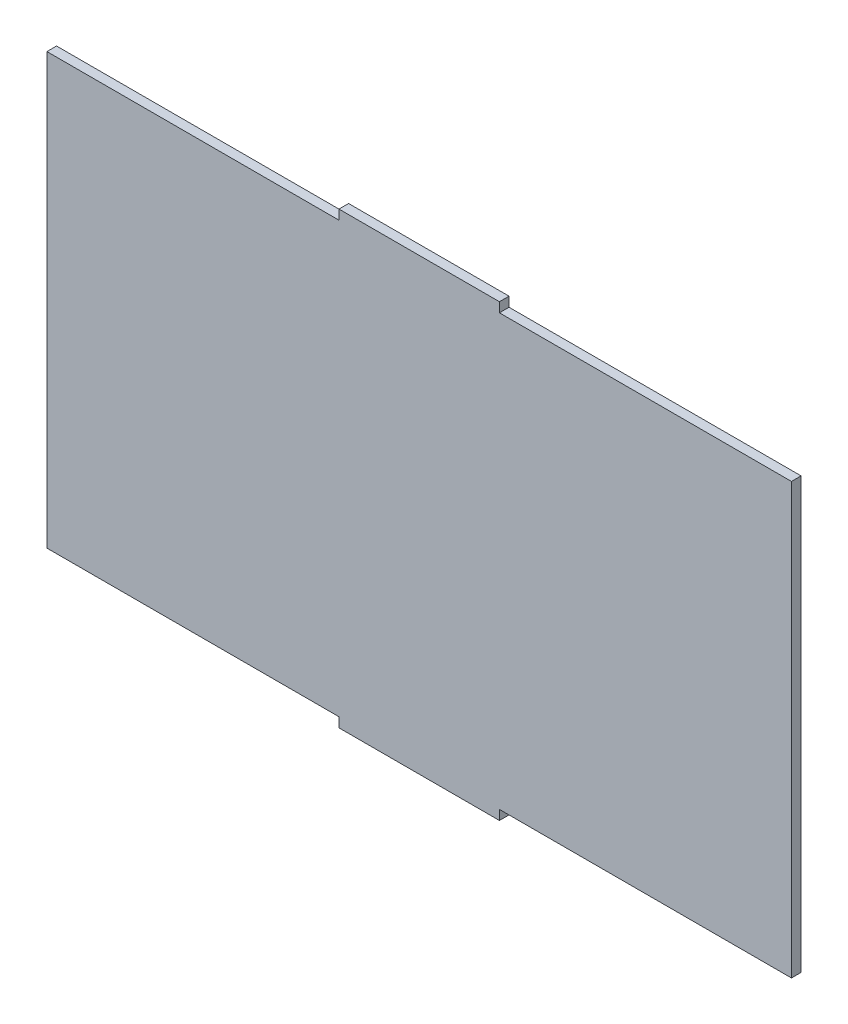
from build123d import *

# Parameters (mm, degrees)
RESSALTO_EXTRUS_O1_DEPTH = 3


with BuildPart() as part:
    # Esboço1 → Ressalto-extrusão1 (new body)
    with BuildSketch(Plane.XY):
        Polygon((0, 0), (91, 0), (91, -3), (141, -3), (141, 0), (232, 0), (232, 134), (141, 134), (141, 137), (91, 137), (91, 134), (0, 134), align=None)
    extrude(amount=RESSALTO_EXTRUS_O1_DEPTH)


solid = part.part
